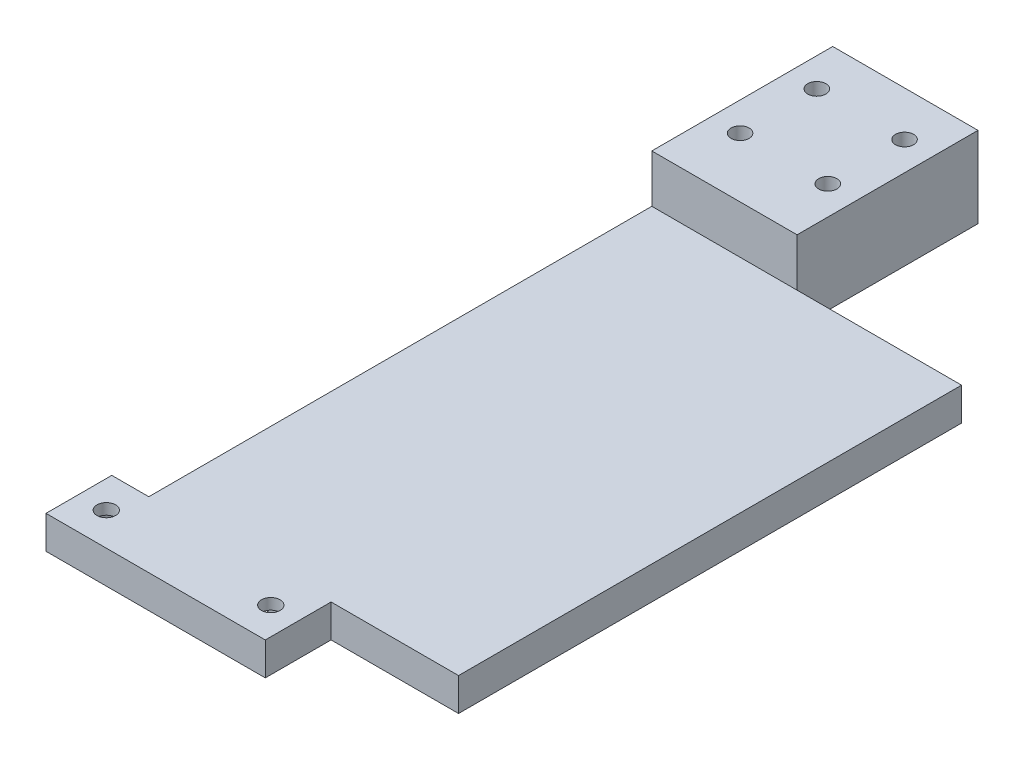
from build123d import *

# Parameters (mm, degrees)
SKETCH6_R                = 1.65
BOSS_EXTRUDE3_DEPTH      = 14.75
SKETCH9_W                = 26.5
SKETCH9_H                = 6
BOSS_EXTRUDE4_DEPTH      = 103.75
BOSS_EXTRUDE6_DEPTH      = 6.75
BOSS_EXTRUDE6_DEPTH_BACK = 33.25
SKETCH14_W               = 12
SKETCH14_H               = 6
SKETCH10_R               = 1.7
CUT_EXTRUDE1_DEPTH       = 107.021813793
SKETCH11_W               = 23.3
SKETCH11_H               = 23.3
CUT_EXTRUDE2_DEPTH       = 4
SKETCH12_W               = 36.472759933
SKETCH12_H               = 9.4
CUT_EXTRUDE3_DEPTH       = 4
SKETCH15_W               = 91.75
SKETCH15_H               = 6
BOSS_EXTRUDE8_DEPTH      = 30


with BuildPart() as part:
    # Sketch6 → Boss-Extrude3 (new body)
    with BuildSketch(Plane(origin=(0, 0, 0), x_dir=(1, 0, 0), z_dir=(0, 1, 0))):
        Polygon((-13.25, 3.3), (-13.25, 0), (13.25, 0), (13.25, 3.3), (13.25, 33), (-13.25, 33), align=None)
        with Locations(Location((8, 10.85, 0), (0, 0, 270))):
            Circle(SKETCH6_R, mode=Mode.SUBTRACT)
        with Locations(Location((8, 24.85, 0), (0, 0, 270))):
            Circle(SKETCH6_R, mode=Mode.SUBTRACT)
        with Locations(Location((-8, 24.85, 0), (0, 0, 270))):
            Circle(SKETCH6_R, mode=Mode.SUBTRACT)
        with Locations(Location((-8, 10.85, 0), (0, 0, 270))):
            Circle(SKETCH6_R, mode=Mode.SUBTRACT)
    extrude(amount=BOSS_EXTRUDE3_DEPTH)

    # Sketch9 → Boss-Extrude4 (add)
    with BuildSketch(Plane.XY):
        with Locations((0, 3)):
            Rectangle(SKETCH9_W, SKETCH9_H)
    extrude(amount=BOSS_EXTRUDE4_DEPTH)

    # Sketch14 → Boss-Extrude6 (add, two sides: drawn at the far end of the back side and taken through both)
    with BuildSketch(Plane.ZY.offset(13.25).offset(-BOSS_EXTRUDE6_DEPTH_BACK)):
        with Locations((97.75, 3)):
            Rectangle(SKETCH14_W, SKETCH14_H)
    extrude(amount=BOSS_EXTRUDE6_DEPTH + BOSS_EXTRUDE6_DEPTH_BACK)

    # Sketch10 → Cut-Extrude1 (cut, through all)
    with BuildSketch(Plane(origin=(0, 6, 0), x_dir=(1, 0, 0), z_dir=(0, 1, 0))):
        with Locations(Location((-15, -97.75, 0), (0, 0, 270))):
            Circle(SKETCH10_R)
        with Locations(Location((15, -97.75, 0), (0, 0, 270))):
            Circle(SKETCH10_R)
    extrude(amount=-CUT_EXTRUDE1_DEPTH, mode=Mode.SUBTRACT)

    # Sketch11 → Cut-Extrude2 (cut)
    with BuildSketch(Plane.XZ):
        with Locations((0, -17.85)):
            Rectangle(SKETCH11_W, SKETCH11_H)
    extrude(amount=-CUT_EXTRUDE2_DEPTH, mode=Mode.SUBTRACT)

    # Sketch12 → Cut-Extrude3 (cut)
    with BuildSketch(Plane.XZ):
        with Locations((-0.463620034, 97.75)):
            Rectangle(SKETCH12_W, SKETCH12_H)
    extrude(amount=-CUT_EXTRUDE3_DEPTH, mode=Mode.SUBTRACT)

    # Sketch15 → Boss-Extrude8 (add)
    with BuildSketch(Plane(origin=(13.25, 0, 0), x_dir=(0, 0, -1), z_dir=(1, 0, 0))):
        with Locations((-45.875, 3)):
            Rectangle(SKETCH15_W, SKETCH15_H)
    extrude(amount=BOSS_EXTRUDE8_DEPTH)


solid = part.part
